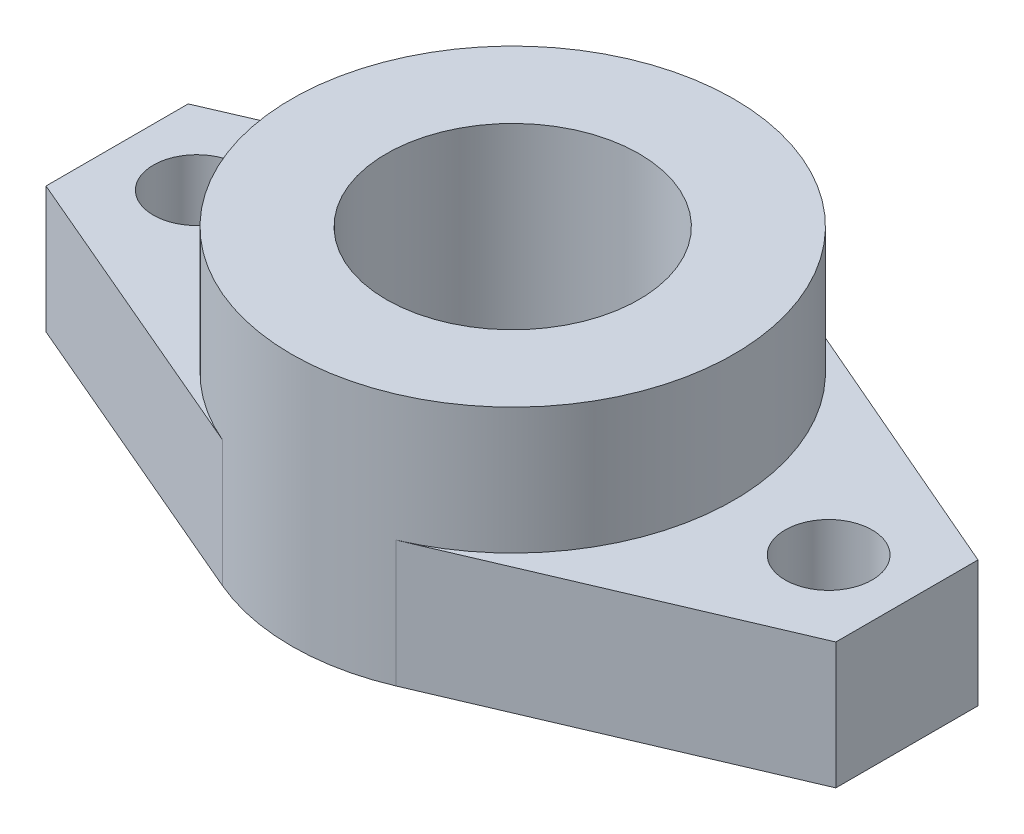
from build123d import *

# Parameters (mm, degrees)
SKETCH_1_R         = 8
EXTRUDE_1_DEPTH    = 8
SKETCH_2_R         = 14
SKETCH_2_R_2       = 8
EXTRUDE_2_DEPTH    = 8
HOLE_WIZARD_M5_1_D = 5.5


with BuildPart() as part:
    # 草图1 → 凸台-拉伸1 (new body)
    with BuildSketch(Plane(origin=(0, 0, 0), x_dir=(1, 0, 0), z_dir=(0, 1, 0))):
        with BuildLine():
            Line((-25, 4.45481098), (-25, -4.54518902))
            Line((-25, -4.54518902), (-5.499282233, -12.874699799))
            ThreePointArc((-5.499282233, -12.874699799), (0, -14), (5.499282233, -12.874699799))
            Line((5.499282233, -12.874699799), (25, -4.54518902))
            Line((25, -4.54518902), (25, 4.45481098))
            Line((25, 4.45481098), (5.549682792, 12.853054925))
            ThreePointArc((5.549682792, 12.853054925), (0, 14), (-5.549682792, 12.853054925))
            Line((-5.549682792, 12.853054925), (-25, 4.45481098))
        make_face()
        with Locations(Location((0, 0, 0), (0, 0, 270))):
            Circle(SKETCH_1_R, mode=Mode.SUBTRACT)
    extrude(amount=EXTRUDE_1_DEPTH)

    # 草图2 → 凸台-拉伸2 (add)
    with BuildSketch(Plane(origin=(0, 8, 0), x_dir=(1, 0, 0), z_dir=(0, 1, 0))):
        with Locations(Location((0, 0, 0), (0, 0, 113.353686186))):
            Circle(SKETCH_2_R)
        with Locations(Location((0, 0, 0), (0, 0, 270))):
            Circle(SKETCH_2_R_2, mode=Mode.SUBTRACT)
    extrude(amount=EXTRUDE_2_DEPTH)

    # M5 间隙孔1 (through all)
    with Locations(Plane(origin=(0, 8, 0), x_dir=(1, 0, 0), z_dir=(0, 1, 0))):
        with Locations((-20, 0), (20, 0)):
            Hole(HOLE_WIZARD_M5_1_D / 2)


solid = part.part
